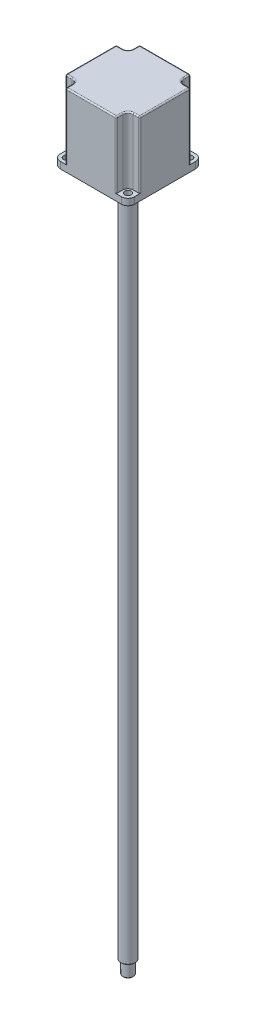
from build123d import *

# Parameters (mm, degrees)
SKETCH1_W                = 57
SKETCH1_H                = 57
EXTRUDE1_DEPTH           = 76
F_5_0_5_DIAMETER_HOLE1_D = 5
SKETCH6_R                = 4
SKETCH6_R_2              = 2.5
EXTRUDE4_DEPTH           = 71
FILLET1_R                = 5
SKETCH7_R                = 3
EXTRUDE5_DEPTH           = 101
SKETCH8_R                = 19.05
EXTRUDE6_DEPTH           = 3
FILLET2_R                = 1
SKETCH9_R                = 5.5
BOSS_EXTRUDE1_DEPTH      = 528
CHAMFER1_SIZE            = 0.5
SKETCH10_R               = 4
BOSS_EXTRUDE2_DEPTH      = 10
CHAMFER2_SIZE            = 0.5
CUT_EXTRUDE1_REACH       = 543.761
SKETCH11_W               = 149.278962391
SKETCH11_H               = 91.97748865
FILLET3_R                = 1


with BuildPart() as part:
    # Sketch1 → Extrude1 (new body)
    with BuildSketch(Plane(origin=(0, 0, 0), x_dir=(1, 0, 0), z_dir=(0, 1, 0))):
        Rectangle(SKETCH1_W, SKETCH1_H)
    extrude(amount=EXTRUDE1_DEPTH)

    # Ø5.0 (5) Diameter Hole1 (through all)
    with Locations(Plane.XZ):
        with Locations((-23.5, 23.5), (23.5, 23.5), (23.5, -23.5), (-23.5, -23.5)):
            Hole(F_5_0_5_DIAMETER_HOLE1_D / 2)

    # Sketch6 → Extrude4 (cut)
    # profile 1 of 12: a face of its own
    with BuildSketch(Plane(origin=(0, 76, 0), x_dir=(1, 0, 0), z_dir=(0, 1, 0))):
        Polygon((-28.5, 28.5), (-19.5, 28.5), (-19.5, 32.511741208), (-33.908905561, 32.511741208), (-33.908905561, 19.5), (-28.5, 19.5), align=None)
    # profile 2 of 12: a face of its own
    with BuildSketch(Plane(origin=(0, 76, 0), x_dir=(1, 0, 0), z_dir=(0, 1, 0))):
        with BuildLine():
            ThreePointArc((-23.5, 19.5), (-26.328427125, 26.328427125), (-19.5, 23.5))
            Line((-19.5, 23.5), (-19.5, 28.5))
            Line((-19.5, 28.5), (-28.5, 28.5))
            Line((-28.5, 28.5), (-28.5, 19.5))
            Line((-28.5, 19.5), (-23.5, 19.5))
        make_face()
    # profile 3 of 12: a face of its own
    with BuildSketch(Plane(origin=(0, 76, 0), x_dir=(1, 0, 0), z_dir=(0, 1, 0))):
        with Locations((-23.5, 23.5)):
            Circle(SKETCH6_R)
        with Locations(Location((-23.5, 23.5, 0), (0, 0, 90))):
            Circle(SKETCH6_R_2, mode=Mode.SUBTRACT)
    # profile 4 of 12: a face of its own
    with BuildSketch(Plane(origin=(0, 76, 0), x_dir=(1, 0, 0), z_dir=(0, 1, 0))):
        Polygon((19.5, 36.471560472), (19.5, 28.5), (28.5, 28.5), (28.5, 19.5), (41.168352552, 19.5), (41.168352552, 36.471560472), align=None)
    # profile 5 of 12: a face of its own
    with BuildSketch(Plane(origin=(0, 76, 0), x_dir=(1, 0, 0), z_dir=(0, 1, 0))):
        with BuildLine():
            Line((28.5, 28.5), (19.5, 28.5))
            Line((19.5, 28.5), (19.5, 23.5))
            ThreePointArc((19.5, 23.5), (23.5, 27.5), (27.5, 23.5))
            ThreePointArc((27.5, 23.5), (26.328427125, 20.671572875), (23.5, 19.5))
            Line((23.5, 19.5), (28.5, 19.5))
            Line((28.5, 19.5), (28.5, 28.5))
        make_face()
    # profile 6 of 12: a face of its own
    with BuildSketch(Plane(origin=(0, 76, 0), x_dir=(1, 0, 0), z_dir=(0, 1, 0))):
        with Locations((23.5, 23.5)):
            Circle(SKETCH6_R)
        with Locations(Location((23.5, 23.5, 0), (0, 0, 90))):
            Circle(SKETCH6_R_2, mode=Mode.SUBTRACT)
    # profile 7 of 12: a face of its own
    with BuildSketch(Plane(origin=(0, 76, 0), x_dir=(1, 0, 0), z_dir=(0, 1, 0))):
        with Locations((23.5, -23.5)):
            Circle(SKETCH6_R)
        with Locations(Location((23.5, -23.5, 0), (0, 0, 90))):
            Circle(SKETCH6_R_2, mode=Mode.SUBTRACT)
    # profile 8 of 12: a face of its own
    with BuildSketch(Plane(origin=(0, 76, 0), x_dir=(1, 0, 0), z_dir=(0, 1, 0))):
        with BuildLine():
            Line((28.5, -28.5), (28.5, -19.5))
            Line((28.5, -19.5), (23.5, -19.5))
            ThreePointArc((23.5, -19.5), (26.328427125, -20.671572875), (27.5, -23.5))
            ThreePointArc((27.5, -23.5), (23.5, -27.5), (19.5, -23.5))
            Line((19.5, -23.5), (19.5, -28.5))
            Line((19.5, -28.5), (28.5, -28.5))
        make_face()
    # profile 9 of 12: a face of its own
    with BuildSketch(Plane(origin=(0, 76, 0), x_dir=(1, 0, 0), z_dir=(0, 1, 0))):
        Polygon((44.252209519, -19.5), (28.5, -19.5), (28.5, -28.5), (19.5, -28.5), (19.5, -40.050429997), (44.252209519, -40.050429997), align=None)
    # profile 10 of 12: a face of its own
    with BuildSketch(Plane(origin=(0, 76, 0), x_dir=(1, 0, 0), z_dir=(0, 1, 0))):
        Polygon((-28.5, -28.5), (-28.5, -19.5), (-37.670786859, -19.5), (-37.670786859, -37.828231874), (-19.5, -37.828231874), (-19.5, -28.5), align=None)
    # profile 11 of 12: a face of its own
    with BuildSketch(Plane(origin=(0, 76, 0), x_dir=(1, 0, 0), z_dir=(0, 1, 0))):
        with BuildLine():
            Line((-23.5, -19.5), (-28.5, -19.5))
            Line((-28.5, -19.5), (-28.5, -28.5))
            Line((-28.5, -28.5), (-19.5, -28.5))
            Line((-19.5, -28.5), (-19.5, -23.5))
            ThreePointArc((-19.5, -23.5), (-26.328427125, -26.328427125), (-23.5, -19.5))
        make_face()
    # profile 12 of 12: a face of its own
    with BuildSketch(Plane(origin=(0, 76, 0), x_dir=(1, 0, 0), z_dir=(0, 1, 0))):
        with Locations((-23.5, -23.5)):
            Circle(SKETCH6_R)
        with Locations(Location((-23.5, -23.5, 0), (0, 0, 90))):
            Circle(SKETCH6_R_2, mode=Mode.SUBTRACT)
    extrude(amount=-EXTRUDE4_DEPTH, mode=Mode.SUBTRACT)

    # Fillet1
    fillet1_edges = [part.edges().sort_by_distance(p)[0] for p in [
        (-28.5, 2.5, 28.5),
        (-28.5, 2.5, -28.5),
        (28.5, 2.5, -28.5),
        (28.5, 2.5, 28.5),
    ]]
    fillet(fillet1_edges, radius=FILLET1_R)



with BuildPart() as body_2:
    # Sketch7 → Extrude5 (new body)
    with BuildSketch(Plane(origin=(0, 76, 0), x_dir=(1, 0, 0), z_dir=(0, 1, 0))):
        with Locations(Location((0, 0, 0), (0, 0, 270))):
            Circle(SKETCH7_R)
    extrude(amount=-EXTRUDE5_DEPTH)


with BuildPart() as part_1:
    add(part.part)

    add(body_2.part)  # Extrude6 merges body 2
    # Sketch8 → Extrude6 (add)
    with BuildSketch(Plane.XZ):
        with Locations(Location((0, 0, 0), (0, 0, 270))):
            Circle(SKETCH8_R)
    extrude(amount=EXTRUDE6_DEPTH)

    # Fillet2
    fillet2_edges = [part_1.edges().sort_by_distance(p)[0] for p in [
        (-28.5, 40.5, 19.5),
        (0, 76, 28.5),
        (-19.5, 40.5, 28.5),
        (-19.5, 76, 26),
        (-20.671572875, 76, 20.671572875),
        (-26, 76, 19.5),
        (-28.5, 76, 0),
        (-28.5, 40.5, -19.5),
        (-19.5, 40.5, -28.5),
        (-19.5, 76, -26),
        (-26, 76, -19.5),
        (-20.671572875, 76, -20.671572875),
        (0, 76, -28.5),
        (19.5, 76, -26),
        (26, 76, -19.5),
        (20.671572875, 76, -20.671572875),
        (19.5, 40.5, -28.5),
        (28.5, 40.5, -19.5),
        (19.5, 40.5, 28.5),
        (28.5, 76, 0),
        (26, 76, 19.5),
        (19.5, 76, 26),
        (20.671572875, 76, 20.671572875),
        (28.5, 40.5, 19.5),
    ]]
    fillet(fillet2_edges, radius=FILLET2_R)

    # Sketch9 → Boss-Extrude1 (add)
    with BuildSketch(Plane.XZ):
        with Locations(Location((0, 0, 0), (0, 0, 270))):
            Circle(SKETCH9_R)
    extrude(amount=BOSS_EXTRUDE1_DEPTH)

    # Chamfer1
    chamfer1_edges = [part_1.edges().sort_by_distance(p)[0] for p in [
        (0, -528, 5.5),
    ]]
    chamfer(chamfer1_edges, length=CHAMFER1_SIZE)

    # Sketch10 → Boss-Extrude2 (add)
    with BuildSketch(Plane.XZ.offset(528)):
        with Locations(Location((0, 0, 0), (0, 0, 270))):
            Circle(SKETCH10_R)
    extrude(amount=BOSS_EXTRUDE2_DEPTH)

    # Chamfer2
    chamfer2_edges = [part_1.edges().sort_by_distance(p)[0] for p in [
        (0, -538, 4),
    ]]
    chamfer(chamfer2_edges, length=CHAMFER2_SIZE)

    # Sketch11 → Cut-Extrude1 (cut, up to next)
    with BuildSketch(Plane.XY.offset(28.5), mode=Mode.PRIVATE) as cut_extrude1_sk1:
        with Locations((-31.906305919, 101.988744325)):
            Rectangle(SKETCH11_W, SKETCH11_H)
    cut_extrude1_tool1 = extrude(cut_extrude1_sk1.sketch, amount=-CUT_EXTRUDE1_REACH, mode=Mode.PRIVATE) & part_1.part
    add(cut_extrude1_tool1.solids().sort_by_distance((-31.906306, 101.988744, 28.5))[0], mode=Mode.SUBTRACT)

    # Fillet3
    fillet3_edges = [part_1.edges().sort_by_distance(p)[0] for p in [
        (19.5, 56, 25.5),
        (19.207106781, 56, 28.207106781),
        (-19.207106781, 56, 28.207106781),
        (-28.207106781, 56, 19.207106781),
        (-28.207106781, 56, -19.207106781),
        (-19.207106781, 56, -28.207106781),
        (19.207106781, 56, -28.207106781),
        (19.5, 56, -25.5),
        (25.5, 56, -19.5),
        (28.207106781, 56, -19.207106781),
        (28.207106781, 56, 19.207106781),
        (25.5, 56, 19.5),
        (0, 56, 28.5),
        (28.5, 56, 0),
        (0, 56, -28.5),
        (-28.5, 56, 0),
        (-25.5, 56, -19.5),
        (-19.5, 56, -25.5),
        (-20.671572875, 56, -20.671572875),
        (20.671572875, 56, -20.671572875),
        (20.671572875, 56, 20.671572875),
        (-19.5, 56, 25.5),
        (-25.5, 56, 19.5),
        (-20.671572875, 56, 20.671572875),
    ]]
    fillet(fillet3_edges, radius=FILLET3_R)


solid = part_1.part
